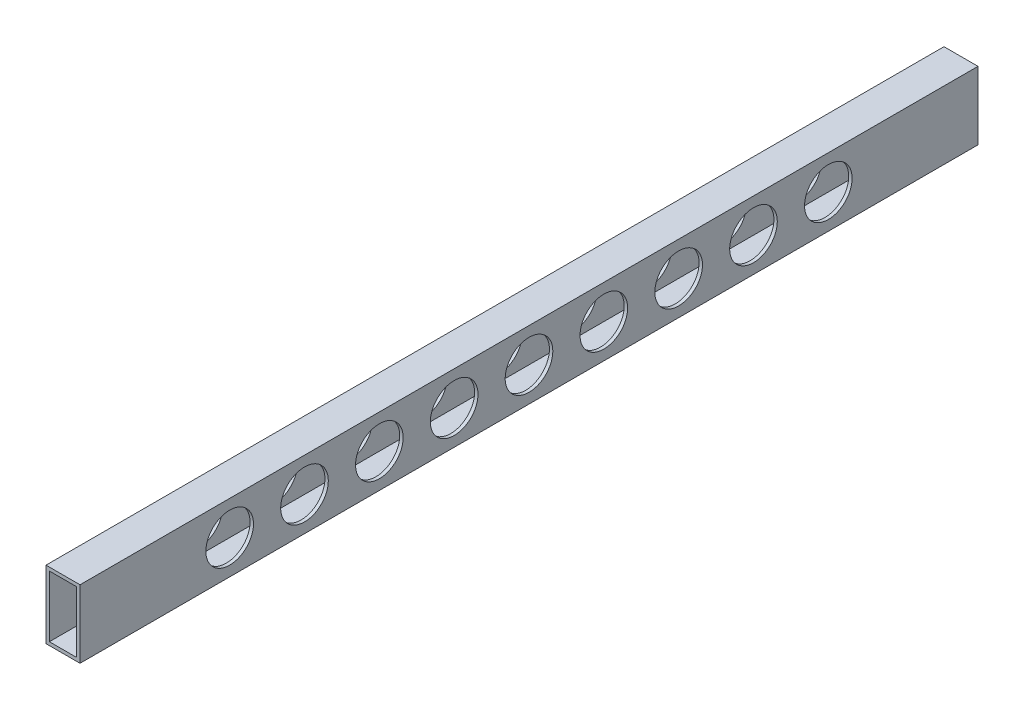
from build123d import *

# Parameters (mm, degrees)
SKETCH1_W           = 31.75
SKETCH1_H           = 63.5
SKETCH1_W_2         = 25.4
SKETCH1_H_2         = 57.15
BOSS_EXTRUDE1_DEPTH = 838.2
SKETCH2_R           = 22.225
CUT_EXTRUDE1_DEPTH  = 31.75


with BuildPart() as part:
    # Sketch1 → Boss-Extrude1 (new body)
    with BuildSketch(Plane.XY):
        with Locations((15.875, 31.75)):
            Rectangle(SKETCH1_W, SKETCH1_H)
        with Locations((15.875, 31.75)):
            Rectangle(SKETCH1_W_2, SKETCH1_H_2, mode=Mode.SUBTRACT)
    extrude(amount=BOSS_EXTRUDE1_DEPTH)

    # Sketch2 → Cut-Extrude1 (cut)
    with BuildSketch(Plane(origin=(31.75, 0, 0), x_dir=(0, 0, -1), z_dir=(1, 0, 0))):
        with Locations((-698.5, 31.75)):
            Circle(SKETCH2_R)
        with Locations((-628.65, 31.75)):
            Circle(SKETCH2_R)
        with Locations((-558.8, 31.75)):
            Circle(SKETCH2_R)
        with Locations((-488.95, 31.75)):
            Circle(SKETCH2_R)
        with Locations((-419.1, 31.75)):
            Circle(SKETCH2_R)
        with Locations((-349.25, 31.75)):
            Circle(SKETCH2_R)
        with Locations((-279.4, 31.75)):
            Circle(SKETCH2_R)
        with Locations((-209.55, 31.75)):
            Circle(SKETCH2_R)
        with Locations((-139.7, 31.75)):
            Circle(SKETCH2_R)
    extrude(amount=-CUT_EXTRUDE1_DEPTH, mode=Mode.SUBTRACT)


solid = part.part
